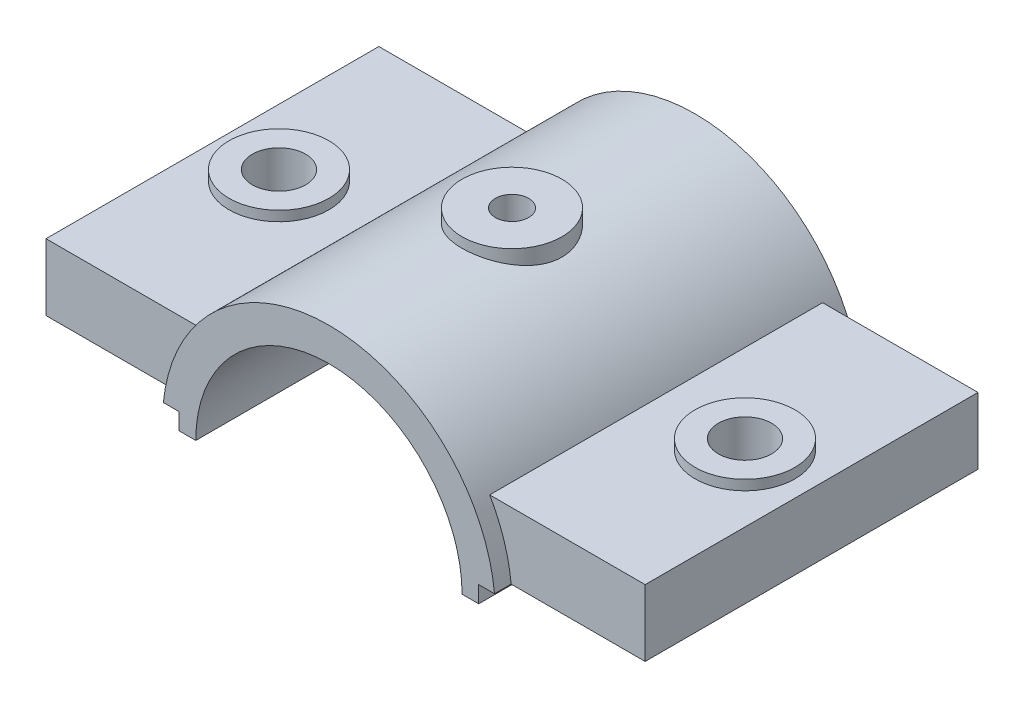
from build123d import *

# Parameters (mm, degrees)
BOSS_EXTRUDE1_DEPTH      = 55
SKETCH4_W                = 180
SKETCH4_H                = 20
BOSS_EXTRUDE2_DEPTH      = 50
CUT_EXTRUDE1_REACH       = 152.665
SKETCH5_W                = 45
SKETCH5_H                = 5
CUT_EXTRUDE2_REACH       = 152.665
SKETCH7_R                = 15
BOSS_EXTRUDE3_DEPTH      = 3
HOLE1_D                  = 16
BOSS_EXTRUDE4_REACH      = 120.042
BOSS_EXTRUDE4_END_RADIUS = 50
SKETCH10_R               = 15
HOLE2_D                  = 10
SKETCH13_R               = 8
CUT_EXTRUDE3_DEPTH       = 42


with BuildPart() as part:
    # Sketch2 → Boss-Extrude1 (new, symmetric)
    with BuildSketch(Plane.XY):
        with BuildLine():
            Line((-50, 0), (50, 0))
            ThreePointArc((50, 0), (0, 50), (-50, 0))
        make_face()
    extrude(amount=BOSS_EXTRUDE1_DEPTH, both=True)

    # Sketch4 → Boss-Extrude2 (add, symmetric)
    with BuildSketch(Plane.XY):
        with Locations((0, 15)):
            Rectangle(SKETCH4_W, SKETCH4_H)
    extrude(amount=BOSS_EXTRUDE2_DEPTH, both=True)

    # Sketch5 → Cut-Extrude1 (cut, up to next)
    with BuildSketch(Plane.XY.offset(55), mode=Mode.PRIVATE) as cut_extrude1_sk1:
        with Locations((67.5, 2.5)):
            Rectangle(SKETCH5_W, SKETCH5_H)
    cut_extrude1_tool1 = extrude(cut_extrude1_sk1.sketch, amount=-CUT_EXTRUDE1_REACH, mode=Mode.PRIVATE) & part.part
    cut_extrude1 = cut_extrude1_tool1.solids().sort_by_distance((67.5, 2.5, 55))[0]
    add(cut_extrude1, mode=Mode.SUBTRACT)

    # Mirror1: Cut-Extrude1 across plane
    add(cut_extrude1.mirror(Plane(origin=(0, 0, 0), x_dir=(0, 0, 1), z_dir=(1, 0, 0))), mode=Mode.SUBTRACT)

    # Sketch6 → Cut-Extrude2 (cut, up to next)
    with BuildSketch(Plane.XY.offset(55), mode=Mode.PRIVATE) as cut_extrude2_sk1:
        with BuildLine():
            Line((-40, 0), (40, 0))
            ThreePointArc((40, 0), (0, 40), (-40, 0))
        make_face()
    cut_extrude2_tool1 = extrude(cut_extrude2_sk1.sketch, amount=-CUT_EXTRUDE2_REACH, mode=Mode.PRIVATE) & part.part
    add(cut_extrude2_tool1.solids().sort_by_distance((0, 16.976527, 55))[0], mode=Mode.SUBTRACT)

    # Sketch7 → Boss-Extrude3 (add)
    with BuildSketch(Plane(origin=(0, 25, 0), x_dir=(1, 0, 0), z_dir=(0, 1, 0))):
        with Locations((70, 0)):
            Circle(SKETCH7_R)
    boss_extrude3 = extrude(amount=BOSS_EXTRUDE3_DEPTH)

    # Mirror2: Boss-Extrude3 across plane
    add(boss_extrude3.mirror(Plane(origin=(0, 0, 0), x_dir=(0, 0, 1), z_dir=(1, 0, 0))))

    # Hole1 (through all)
    with Locations(Plane(origin=(0, 28, 0), x_dir=(1, 0, 0), z_dir=(0, 1, 0))):
        with Locations((70, 0), (-70, 0)):
            Hole(HOLE1_D / 2)

    # Boss-Extrude4: up to this cylinder (the profile starts outside it)
    boss_extrude4_end = Plane(origin=(0, 0, 0), z_dir=(0, 0, -1)) * Cylinder(BOSS_EXTRUDE4_END_RADIUS, 341.084, mode=Mode.PRIVATE)
    # Sketch10 → Boss-Extrude4 (add, up to the surface)
    with BuildSketch(Plane(origin=(0, 53, 0), x_dir=(1, 0, 0), z_dir=(0, 1, 0)), mode=Mode.PRIVATE) as boss_extrude4_sk1:
        with Locations(Location((0, 0, 0), (0, 0, 270))):
            Circle(SKETCH10_R)
    boss_extrude4_tool1 = extrude(boss_extrude4_sk1.sketch, amount=-BOSS_EXTRUDE4_REACH, mode=Mode.PRIVATE) - boss_extrude4_end
    add(boss_extrude4_tool1.solids().sort_by_distance((0, 53, 0))[0])

    # Hole2 (through all)
    with Locations(Plane(origin=(0, 53, 0), x_dir=(1, 0, 0), z_dir=(0, 1, 0))):
        with Locations((0, 0)):
            Hole(HOLE2_D / 2)

    # Sketch13 → Cut-Extrude3 (cut)
    with BuildSketch(Plane(origin=(0, 0, 0), x_dir=(1, 0, 0), z_dir=(0, 1, 0))):
        with Locations(Location((0, 0, 0), (0, 0, 90))):
            Circle(SKETCH13_R)
    extrude(amount=CUT_EXTRUDE3_DEPTH, mode=Mode.SUBTRACT)


solid = part.part
